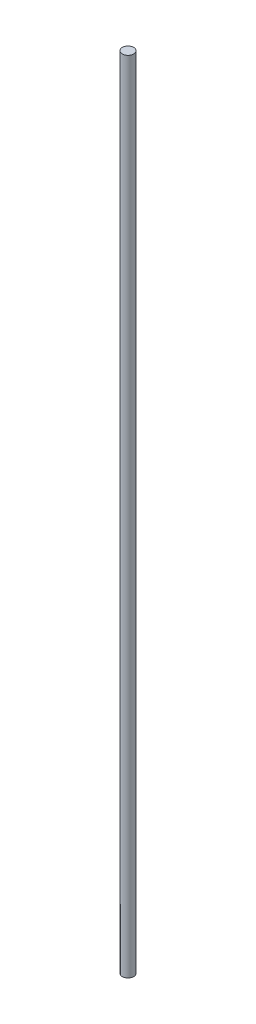
from build123d import *

# Parameters (mm, degrees)
SKETCH_1_R      = 2.5
EXTRUDE_1_DEPTH = 350


with BuildPart() as part:
    # 草图1 → 凸台-拉伸1 (new body)
    with BuildSketch(Plane(origin=(0, 0, 0), x_dir=(1, 0, 0), z_dir=(0, 1, 0))):
        with Locations(Location((0, 0, 0), (0, 0, 270))):
            Circle(SKETCH_1_R)
    extrude(amount=EXTRUDE_1_DEPTH)


solid = part.part
